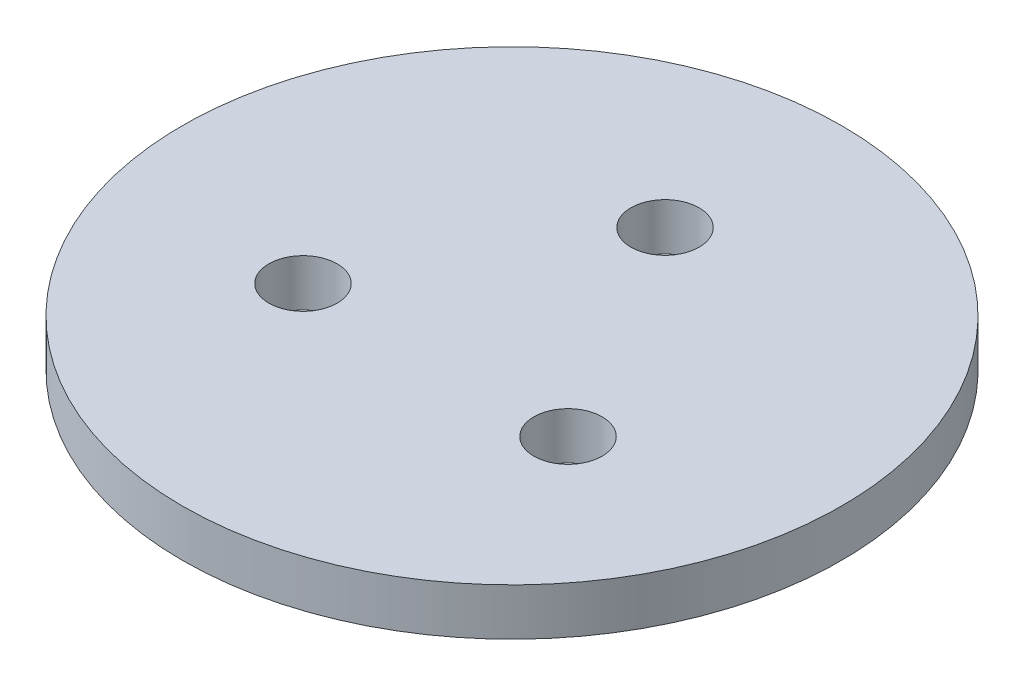
from build123d import *

# Parameters (mm, degrees)
ESQUISSE4_R                  = 14
BOSS_EXTRU_1_DEPTH           = 1
D_GAGEMENT_M2_51_D           = 2.9
R_P_TITION_CIRCULAIRE1_COUNT = 3


with BuildPart() as part:
    # Esquisse4 → Boss.-Extru.1 (new, symmetric)
    with BuildSketch(Plane(origin=(0, 0, 0), x_dir=(1, 0, 0), z_dir=(0, 1, 0))):
        with Locations(Location((0, 0, 0), (0, 0, 270))):
            Circle(ESQUISSE4_R)
    extrude(amount=BOSS_EXTRU_1_DEPTH, both=True)

    # Dégagement M2.51 (through all)
    with Locations(Plane(origin=(0, 1, 0), x_dir=(1, 0, 0), z_dir=(0, 1, 0))):
        with Locations((0, 6.5)):
            d_gagement_m2_51 = Hole(D_GAGEMENT_M2_51_D / 2)

    # Répétition circulaire1: Dégagement M2.51 ×3 about axis
    r_p_tition_circulaire1_axis = Axis((0, 0, 0), (0, 1, 0))
    for i in range(1, R_P_TITION_CIRCULAIRE1_COUNT):
        add(d_gagement_m2_51.rotate(r_p_tition_circulaire1_axis, i * 360 / R_P_TITION_CIRCULAIRE1_COUNT), mode=Mode.SUBTRACT)


solid = part.part
